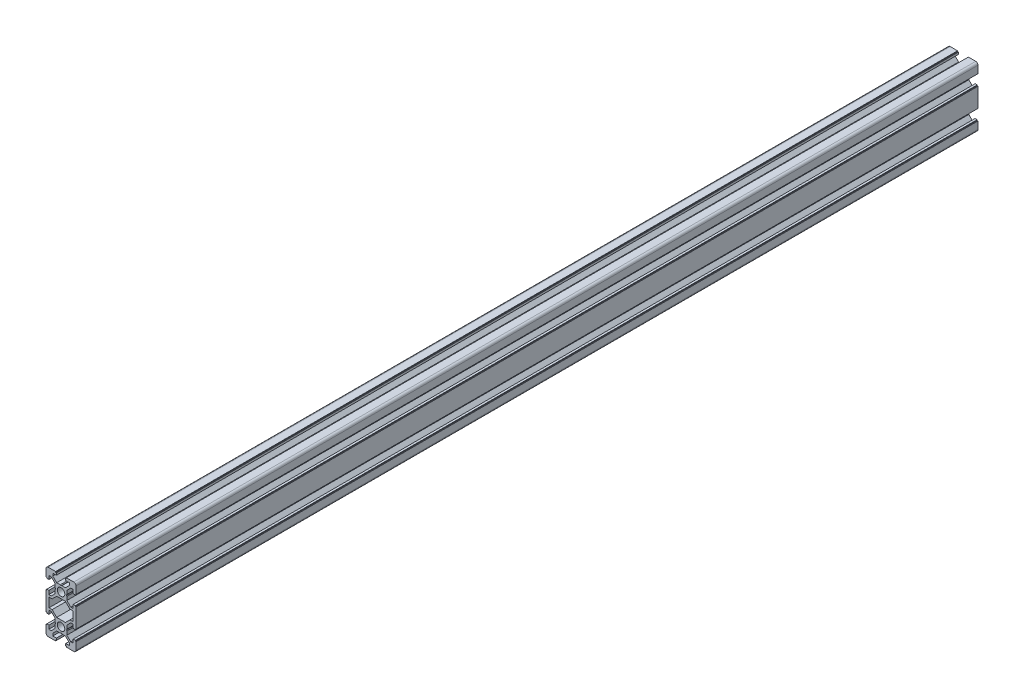
from build123d import *

# Parameters (mm, degrees)
SKETCH_30_R     = 2.5
EXTRUDE_3_DEPTH = 600


with BuildPart() as part:
    # 草图30 → 凸台-拉伸3 (new body)
    with BuildSketch(Plane.XY):
        with BuildLine():
            Line((-8.1, 14.5), (-8.1, 16.9))
            Line((-8.1, 16.9), (-9.5, 16.9))
            Line((-9.5, 16.9), (-9.5, 16.4))
            Line((-9.5, 16.4), (-10, 16.4))
            Line((-10, 16.4), (-10, 3.6))
            Line((-10, 3.6), (-9.5, 3.6))
            Line((-9.5, 3.6), (-9.5, 3.1))
            Line((-9.5, 3.1), (-8.1, 3.1))
            Line((-8.1, 3.1), (-8.1, 5.5))
            Line((-8.1, 5.5), (-6.489949494, 5.5))
            Line((-6.489949494, 5.5), (-3.9, 2.910050506))
            Line((-3.9, 2.910050506), (-3.9, 0.519615242))
            Line((-3.9, 0.519615242), (-3.6, 0))
            Line((-3.6, 0), (-3.9, -0.519615242))
            Line((-3.9, -0.519615242), (-3.9, -2.910050506))
            Line((-3.9, -2.910050506), (-6.489949494, -5.5))
            Line((-6.489949494, -5.5), (-8.1, -5.5))
            Line((-8.1, -5.5), (-8.1, -3.1))
            Line((-8.1, -3.1), (-9.5, -3.1))
            Line((-9.5, -3.1), (-9.5, -3.6))
            Line((-9.5, -3.6), (-10, -3.6))
            Line((-10, -3.6), (-10, -8.5))
            ThreePointArc((-10, -8.5), (-9.560660172, -9.560660172), (-8.5, -10))
            Line((-8.5, -10), (-3.6, -10))
            Line((-3.6, -10), (-3.6, -9.5))
            Line((-3.6, -9.5), (-3.1, -9.5))
            Line((-3.1, -9.5), (-3.1, -8.1))
            Line((-3.1, -8.1), (-5.5, -8.1))
            Line((-5.5, -8.1), (-5.5, -6.489949494))
            Line((-5.5, -6.489949494), (-2.910050506, -3.9))
            Line((-2.910050506, -3.9), (-0.519615242, -3.9))
            Line((-0.519615242, -3.9), (0, -3.6))
            Line((0, -3.6), (0.519615242, -3.9))
            Line((0.519615242, -3.9), (2.910050506, -3.9))
            Line((2.910050506, -3.9), (5.5, -6.489949494))
            Line((5.5, -6.489949494), (5.5, -8.1))
            Line((5.5, -8.1), (3.1, -8.1))
            Line((3.1, -8.1), (3.1, -9.5))
            Line((3.1, -9.5), (3.6, -9.5))
            Line((3.6, -9.5), (3.6, -10))
            Line((3.6, -10), (8.5, -10))
            ThreePointArc((8.5, -10), (9.560660172, -9.560660172), (10, -8.5))
            Line((10, -8.5), (10, -3.6))
            Line((10, -3.6), (9.5, -3.6))
            Line((9.5, -3.6), (9.5, -3.1))
            Line((9.5, -3.1), (8.1, -3.1))
            Line((8.1, -3.1), (8.1, -5.5))
            Line((8.1, -5.5), (6.489949494, -5.5))
            Line((6.489949494, -5.5), (3.9, -2.910050506))
            Line((3.9, -2.910050506), (3.9, -0.519615242))
            Line((3.9, -0.519615242), (3.6, 0))
            Line((3.6, 0), (3.9, 0.519615242))
            Line((3.9, 0.519615242), (3.9, 2.910050506))
            Line((3.9, 2.910050506), (6.489949494, 5.5))
            Line((6.489949494, 5.5), (8.1, 5.5))
            Line((8.1, 5.5), (8.1, 3.1))
            Line((8.1, 3.1), (9.5, 3.1))
            Line((9.5, 3.1), (9.5, 3.6))
            Line((9.5, 3.6), (10, 3.6))
            Line((10, 3.6), (10, 16.4))
            Line((10, 16.4), (9.5, 16.4))
            Line((9.5, 16.4), (9.5, 16.9))
            Line((9.5, 16.9), (8.1, 16.9))
            Line((8.1, 16.9), (8.1, 14.5))
            Line((8.1, 14.5), (6.489949494, 14.5))
            Line((6.489949494, 14.5), (3.9, 17.089949494))
            Line((3.9, 17.089949494), (3.9, 19.480384758))
            Line((3.9, 19.480384758), (3.6, 20))
            Line((3.6, 20), (3.9, 20.519615242))
            Line((3.9, 20.519615242), (3.9, 22.910050506))
            Line((3.9, 22.910050506), (6.489949494, 25.5))
            Line((6.489949494, 25.5), (8.1, 25.5))
            Line((8.1, 25.5), (8.1, 23.1))
            Line((8.1, 23.1), (9.5, 23.1))
            Line((9.5, 23.1), (9.5, 23.6))
            Line((9.5, 23.6), (10, 23.6))
            Line((10, 23.6), (10, 28.5))
            ThreePointArc((10, 28.5), (9.560660172, 29.560660172), (8.5, 30))
            Line((8.5, 30), (3.6, 30))
            Line((3.6, 30), (3.6, 29.5))
            Line((3.6, 29.5), (3.1, 29.5))
            Line((3.1, 29.5), (3.1, 28.1))
            Line((3.1, 28.1), (5.5, 28.1))
            Line((5.5, 28.1), (5.5, 26.489949494))
            Line((5.5, 26.489949494), (2.910050506, 23.9))
            Line((2.910050506, 23.9), (0.519615242, 23.9))
            Line((0.519615242, 23.9), (0, 23.6))
            Line((0, 23.6), (-0.519615242, 23.9))
            Line((-0.519615242, 23.9), (-2.910050506, 23.9))
            Line((-2.910050506, 23.9), (-5.5, 26.489949494))
            Line((-5.5, 26.489949494), (-5.5, 28.1))
            Line((-5.5, 28.1), (-3.1, 28.1))
            Line((-3.1, 28.1), (-3.1, 29.5))
            Line((-3.1, 29.5), (-3.6, 29.5))
            Line((-3.6, 29.5), (-3.6, 30))
            Line((-3.6, 30), (-8.5, 30))
            ThreePointArc((-8.5, 30), (-9.560660172, 29.560660172), (-10, 28.5))
            Line((-10, 28.5), (-10, 23.6))
            Line((-10, 23.6), (-9.5, 23.6))
            Line((-9.5, 23.6), (-9.5, 23.1))
            Line((-9.5, 23.1), (-8.1, 23.1))
            Line((-8.1, 23.1), (-8.1, 25.5))
            Line((-8.1, 25.5), (-6.489949494, 25.5))
            Line((-6.489949494, 25.5), (-3.9, 22.910050506))
            Line((-3.9, 22.910050506), (-3.9, 20.519615242))
            Line((-3.9, 20.519615242), (-3.6, 20))
            Line((-3.6, 20), (-3.9, 19.480384758))
            Line((-3.9, 19.480384758), (-3.9, 17.089949494))
            Line((-3.9, 17.089949494), (-6.489949494, 14.5))
            Line((-6.489949494, 14.5), (-8.1, 14.5))
        make_face()
        with Locations((0, 20)):
            Circle(SKETCH_30_R, mode=Mode.SUBTRACT)
        Circle(SKETCH_30_R, mode=Mode.SUBTRACT)
        Polygon((5.910050506, 6.9), (2.910050506, 3.9), (-2.910050506, 3.9), (-5.910050506, 6.9), (-8, 6.9), (-8, 13.1), (-5.910050506, 13.1), (-2.910050506, 16.1), (2.910050506, 16.1), (5.910050506, 13.1), (8, 13.1), (8, 6.9), align=None, mode=Mode.SUBTRACT)
    extrude(amount=EXTRUDE_3_DEPTH)


solid = part.part
